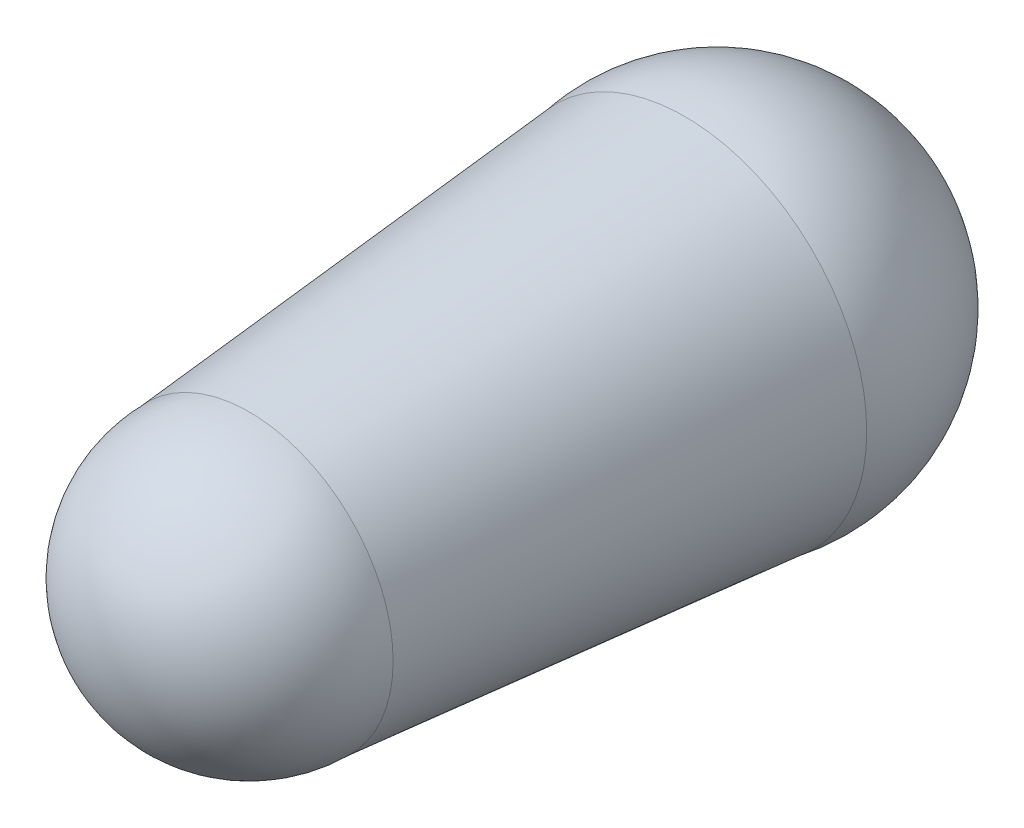
from build123d import *

# Parameters (mm, degrees)
SKETCH2_R           = 3.95
BOSS_EXTRUDE1_DEPTH = 10
BOSS_EXTRUDE1_TAPER = 5


with BuildPart() as part:
    # Sketch1 → Revolve1 (revolve)
    with BuildSketch(Plane.XY):
        with BuildLine():
            Line((0, 3.95), (0, -3.95))
            ThreePointArc((0, -3.95), (3.95, 0), (0, 3.95))
        make_face()
    revolve(axis=Axis((0, 3.95, 0), (0, -1, 0)))

    # Sketch2 → Boss-Extrude1 (add)
    with BuildSketch(Plane.XY):
        Circle(SKETCH2_R)
    extrude(amount=BOSS_EXTRUDE1_DEPTH, taper=BOSS_EXTRUDE1_TAPER)

    # Sketch3 → Revolve2 (revolve)
    with BuildSketch(Plane.XY.offset(10)):
        with BuildLine():
            Line((0, 3.075113365), (0, -3.075113365))
            ThreePointArc((0, -3.075113365), (3.075113365, 0), (0, 3.075113365))
        make_face()
    revolve(axis=Axis((0, 3.075113365, 10), (0, -1, 0)))


solid = part.part
